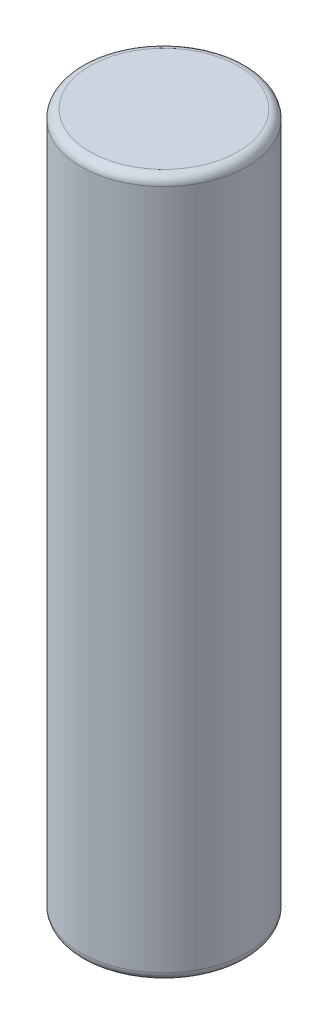
from build123d import *

# Parameters (mm, degrees)
SKETCH_1_R      = 9.5
EXTRUDE_1_DEPTH = 80
FILLET_1_R      = 1


with BuildPart() as part:
    # 草图1 → 凸台-拉伸1 (new body)
    with BuildSketch(Plane(origin=(0, 0, 0), x_dir=(1, 0, 0), z_dir=(0, 1, 0))):
        with Locations(Location((0, 0, 0), (0, 0, 270))):
            Circle(SKETCH_1_R)
    extrude(amount=EXTRUDE_1_DEPTH)

    # 圆角1
    fillet_1_edges = [part.edges().sort_by_distance(p)[0] for p in [
        (0, 0, -9.5),
        (0, 80, -9.5),
    ]]
    fillet(fillet_1_edges, radius=FILLET_1_R)


solid = part.part
